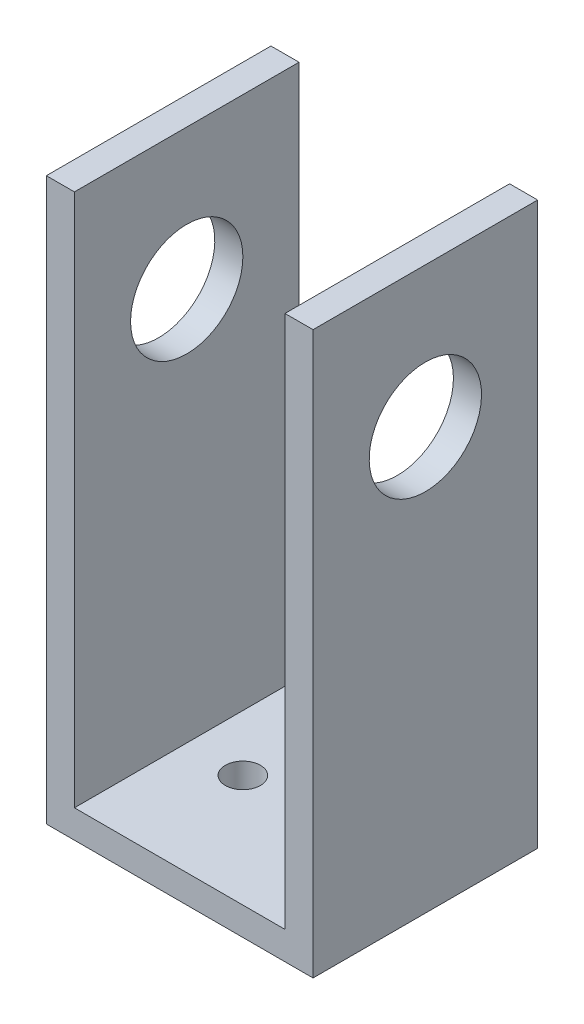
from build123d import *

# Parameters (mm, degrees)
EXTRUDE_1_DEPTH     = 40
SKETCH_2_R          = 4
CUT_EXTRUDE_1_DEPTH = 60.674114991
SKETCH_5_W          = 24
SKETCH_5_H          = 40
CUT_EXTRUDE_4_DEPTH = 60.674114991
SKETCH_6_R          = 1.25
CUT_EXTRUDE_5_DEPTH = 60.674114991


with BuildPart() as part:
    # 草图1 → 凸台-拉伸1 (new body)
    with BuildSketch(Plane.XY):
        Polygon((0, 0), (2, 0), (17, 0), (19, 0), (19, 40), (17, 40), (17, 2), (2, 2), (2, 40), (0, 40), align=None)
    extrude(amount=EXTRUDE_1_DEPTH)

    # 草图2 → 切除-拉伸1 (cut, through all)
    with BuildSketch(Plane(origin=(19, 0, 0), x_dir=(0, 0, -1), z_dir=(1, 0, 0))):
        with Locations(Location((-32, 30, 0), (0, 0, 90))):
            Circle(SKETCH_2_R)
    extrude(amount=-CUT_EXTRUDE_1_DEPTH, mode=Mode.SUBTRACT)

    # 草图5 → 切除-拉伸4 (cut, through all)
    with BuildSketch(Plane.ZY):
        with Locations((12, 20)):
            Rectangle(SKETCH_5_W, SKETCH_5_H)
    extrude(amount=-CUT_EXTRUDE_4_DEPTH, mode=Mode.SUBTRACT)

    # 草图6 → 切除-拉伸5 (cut, through all)
    with BuildSketch(Plane.XZ):
        with Locations((13, 32)):
            Circle(SKETCH_6_R)
        with Locations(Location((6, 32, 0), (0, 0, 270))):
            Circle(SKETCH_6_R)
    extrude(amount=-CUT_EXTRUDE_5_DEPTH, mode=Mode.SUBTRACT)


solid = part.part
